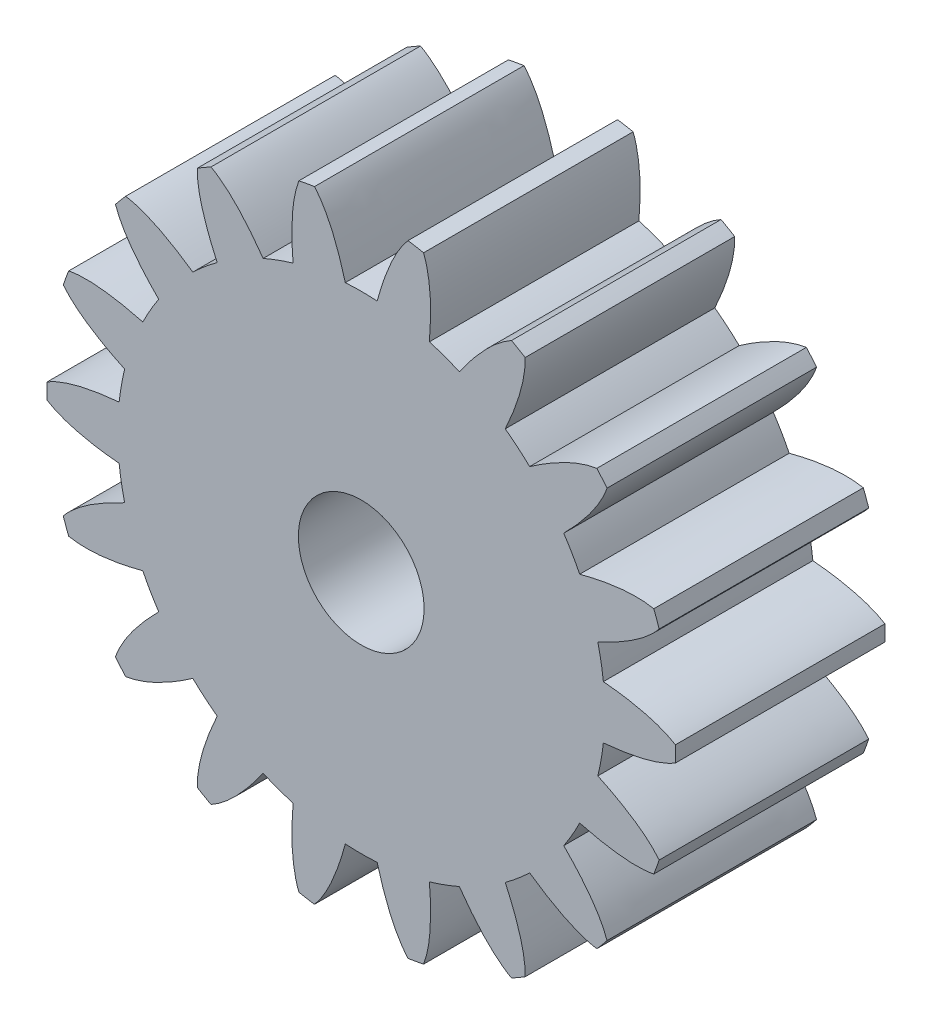
from build123d import *

# Parameters (mm, degrees)
SKETCH2_R           = 3
BOSS_EXTRUDE1_DEPTH = 10


with BuildPart() as part:
    # Sketch2 → Boss-Extrude1 (new body)
    with BuildSketch(Plane.XY):
        with BuildLine():
            ThreePointArc((-3.252993239, 11.159543494), (-3.975642146, 10.922987024), (-4.681278893, 10.639690029))
            add(Edge.make_bspline(
                [(-7.171179852, 13.174755388), (-6.030977377, 12.550803972), (-4.681278893, 10.639690029)],
                knots=[0, 0, 0, 0.715421341, 0.715421341, 0.715421341], degree=2))
            ThreePointArc((-7.171179852, 13.174755388), (-7.5, 12.990381057), (-7.824082928, 12.797801621))
            add(Edge.make_bspline(
                [(-7.824082928, 12.797801621), (-7.853826389, 11.498381604), (-6.873602407, 9.373951458)],
                knots=[0, 0, 0, 0.715421341, 0.715421341, 0.715421341], degree=2))
            ThreePointArc((-6.873602407, 9.373951458), (-7.471763175, 8.904500607), (-8.037951541, 8.39694653))
            add(Edge.make_bspline(
                [(-11.244736516, 9.927532458), (-9.95989271, 9.731182131), (-8.037951541, 8.39694653)],
                knots=[0, 0, 0, 0.715421341, 0.715421341, 0.715421341], degree=2))
            ThreePointArc((-11.244736516, 9.927532458), (-11.490666647, 9.641814145), (-11.729338937, 9.350005781))
            add(Edge.make_bspline(
                [(-11.729338937, 9.350005781), (-11.312860827, 8.118777517), (-9.665153682, 6.457722533)],
                knots=[0, 0, 0, 0.715421341, 0.715421341, 0.715421341], degree=2))
            ThreePointArc((-9.665153682, 6.457722533), (-10.066679294, 5.812), (-10.425128605, 5.141407354))
            add(Edge.make_bspline(
                [(-13.962012, 5.482902598), (-12.687497991, 5.737836107), (-10.425128605, 5.141407354)],
                knots=[0, 0, 0, 0.715421341, 0.715421341, 0.715421341], degree=2))
            ThreePointArc((-13.962012, 5.482902598), (-14.095389312, 5.13030215), (-14.219863563, 4.774461253))
            add(Edge.make_bspline(
                [(-14.219863563, 4.774461253), (-13.407397289, 3.759929041), (-11.29094478, 2.762596964)],
                knots=[0, 0, 0, 0.715421341, 0.715421341, 0.715421341], degree=2))
            ThreePointArc((-11.29094478, 2.762596964), (-11.447405321, 2.018486417), (-11.554881301, 1.265738571))
            add(Edge.make_bspline(
                [(-14.995262781, 0.376953767), (-13.884803766, 1.052422368), (-11.554881301, 1.265738571)],
                knots=[0, 0, 0, 0.715421341, 0.715421341, 0.715421341], degree=2))
            ThreePointArc((-14.995262781, 0.376953767), (-15, 0), (-14.995262781, -0.376953767))
            add(Edge.make_bspline(
                [(-14.995262781, -0.376953767), (-13.884803766, -1.052422368), (-11.554881301, -1.265738571)],
                knots=[0, 0, 0, 0.715421341, 0.715421341, 0.715421341], degree=2))
            ThreePointArc((-11.554881301, -1.265738571), (-11.447405321, -2.018486417), (-11.29094478, -2.762596964))
            add(Edge.make_bspline(
                [(-14.219863563, -4.774461253), (-13.407397289, -3.759929041), (-11.29094478, -2.762596964)],
                knots=[0, 0, 0, 0.715421341, 0.715421341, 0.715421341], degree=2))
            ThreePointArc((-14.219863563, -4.774461253), (-14.095389312, -5.13030215), (-13.962012, -5.482902598))
            add(Edge.make_bspline(
                [(-13.962012, -5.482902598), (-12.687497991, -5.737836107), (-10.425128605, -5.141407354)],
                knots=[0, 0, 0, 0.715421341, 0.715421341, 0.715421341], degree=2))
            ThreePointArc((-10.425128605, -5.141407354), (-10.066679294, -5.812), (-9.665153682, -6.457722533))
            add(Edge.make_bspline(
                [(-11.729338937, -9.350005781), (-11.312860827, -8.118777517), (-9.665153682, -6.457722533)],
                knots=[0, 0, 0, 0.715421341, 0.715421341, 0.715421341], degree=2))
            ThreePointArc((-11.729338937, -9.350005781), (-11.490666647, -9.641814145), (-11.244736516, -9.927532458))
            add(Edge.make_bspline(
                [(-11.244736516, -9.927532458), (-9.95989271, -9.731182131), (-8.037951541, -8.39694653)],
                knots=[0, 0, 0, 0.715421341, 0.715421341, 0.715421341], degree=2))
            ThreePointArc((-8.037951541, -8.39694653), (-7.471763175, -8.904500607), (-6.873602407, -9.373951458))
            add(Edge.make_bspline(
                [(-7.824082928, -12.797801621), (-7.853826389, -11.498381604), (-6.873602407, -9.373951458)],
                knots=[0, 0, 0, 0.715421341, 0.715421341, 0.715421341], degree=2))
            ThreePointArc((-7.824082928, -12.797801621), (-7.5, -12.990381057), (-7.171179852, -13.174755388))
            add(Edge.make_bspline(
                [(-7.171179852, -13.174755388), (-6.030977377, -12.550803972), (-4.681278893, -10.639690029)],
                knots=[0, 0, 0, 0.715421341, 0.715421341, 0.715421341], degree=2))
            ThreePointArc((-4.681278893, -10.639690029), (-3.975642146, -10.922987024), (-3.252993239, -11.159543494))
            add(Edge.make_bspline(
                [(-2.975127047, -14.70199371), (-3.447504579, -13.491111171), (-3.252993239, -11.159543494)],
                knots=[0, 0, 0, 0.715421341, 0.715421341, 0.715421341], degree=2))
            ThreePointArc((-2.975127047, -14.70199371), (-2.604722665, -14.772116295), (-2.232673064, -14.832908379))
            add(Edge.make_bspline(
                [(-2.232673064, -14.832908379), (-1.374637164, -13.856613624), (-0.759974923, -11.599129886)],
                knots=[0, 0, 0, 0.715421341, 0.715421341, 0.715421341], degree=2))
            ThreePointArc((-0.759974923, -11.599129886), (0, -11.624), (0.759974923, -11.599129886))
            add(Edge.make_bspline(
                [(2.232673064, -14.832908379), (1.374637164, -13.856613624), (0.759974923, -11.599129886)],
                knots=[0, 0, 0, 0.715421341, 0.715421341, 0.715421341], degree=2))
            ThreePointArc((2.232673064, -14.832908379), (2.604722665, -14.772116295), (2.975127047, -14.70199371))
            add(Edge.make_bspline(
                [(2.975127047, -14.70199371), (3.447504579, -13.491111171), (3.252993239, -11.159543494)],
                knots=[0, 0, 0, 0.715421341, 0.715421341, 0.715421341], degree=2))
            ThreePointArc((3.252993239, -11.159543494), (3.975642146, -10.922987024), (4.681278893, -10.639690029))
            add(Edge.make_bspline(
                [(7.171179852, -13.174755388), (6.030977377, -12.550803972), (4.681278893, -10.639690029)],
                knots=[0, 0, 0, 0.715421341, 0.715421341, 0.715421341], degree=2))
            ThreePointArc((7.171179852, -13.174755388), (7.5, -12.990381057), (7.824082928, -12.797801621))
            add(Edge.make_bspline(
                [(7.824082928, -12.797801621), (7.853826389, -11.498381604), (6.873602407, -9.373951458)],
                knots=[0, 0, 0, 0.715421341, 0.715421341, 0.715421341], degree=2))
            ThreePointArc((6.873602407, -9.373951458), (7.471763175, -8.904500607), (8.037951541, -8.39694653))
            add(Edge.make_bspline(
                [(11.244736516, -9.927532458), (9.95989271, -9.731182131), (8.037951541, -8.39694653)],
                knots=[0, 0, 0, 0.715421341, 0.715421341, 0.715421341], degree=2))
            ThreePointArc((11.244736516, -9.927532458), (11.490666647, -9.641814145), (11.729338937, -9.350005781))
            add(Edge.make_bspline(
                [(11.729338937, -9.350005781), (11.312860827, -8.118777517), (9.665153682, -6.457722533)],
                knots=[0, 0, 0, 0.715421341, 0.715421341, 0.715421341], degree=2))
            ThreePointArc((9.665153682, -6.457722533), (10.066679294, -5.812), (10.425128605, -5.141407354))
            add(Edge.make_bspline(
                [(13.962012, -5.482902598), (12.687497991, -5.737836107), (10.425128605, -5.141407354)],
                knots=[0, 0, 0, 0.715421341, 0.715421341, 0.715421341], degree=2))
            ThreePointArc((13.962012, -5.482902598), (14.095389312, -5.13030215), (14.219863563, -4.774461253))
            add(Edge.make_bspline(
                [(14.219863563, -4.774461253), (13.407397289, -3.759929041), (11.29094478, -2.762596964)],
                knots=[0, 0, 0, 0.715421341, 0.715421341, 0.715421341], degree=2))
            ThreePointArc((11.29094478, -2.762596964), (11.447405321, -2.018486417), (11.554881301, -1.265738571))
            add(Edge.make_bspline(
                [(14.995262781, -0.376953767), (13.884803766, -1.052422368), (11.554881301, -1.265738571)],
                knots=[0, 0, 0, 0.715421341, 0.715421341, 0.715421341], degree=2))
            ThreePointArc((14.995262781, -0.376953767), (15, 0), (14.995262781, 0.376953767))
            add(Edge.make_bspline(
                [(14.995262781, 0.376953767), (13.884803766, 1.052422368), (11.554881301, 1.265738571)],
                knots=[0, 0, 0, 0.715421341, 0.715421341, 0.715421341], degree=2))
            ThreePointArc((11.554881301, 1.265738571), (11.447405321, 2.018486417), (11.29094478, 2.762596964))
            add(Edge.make_bspline(
                [(14.219863563, 4.774461253), (13.407397289, 3.759929041), (11.29094478, 2.762596964)],
                knots=[0, 0, 0, 0.715421341, 0.715421341, 0.715421341], degree=2))
            ThreePointArc((14.219863563, 4.774461253), (14.095389312, 5.13030215), (13.962012, 5.482902598))
            add(Edge.make_bspline(
                [(13.962012, 5.482902598), (12.687497991, 5.737836107), (10.425128605, 5.141407354)],
                knots=[0, 0, 0, 0.715421341, 0.715421341, 0.715421341], degree=2))
            ThreePointArc((10.425128605, 5.141407354), (10.066679294, 5.812), (9.665153682, 6.457722533))
            add(Edge.make_bspline(
                [(11.729338937, 9.350005781), (11.312860827, 8.118777517), (9.665153682, 6.457722533)],
                knots=[0, 0, 0, 0.715421341, 0.715421341, 0.715421341], degree=2))
            ThreePointArc((11.729338937, 9.350005781), (11.490666647, 9.641814145), (11.244736516, 9.927532458))
            add(Edge.make_bspline(
                [(11.244736516, 9.927532458), (9.95989271, 9.731182131), (8.037951541, 8.39694653)],
                knots=[0, 0, 0, 0.715421341, 0.715421341, 0.715421341], degree=2))
            ThreePointArc((8.037951541, 8.39694653), (7.471763175, 8.904500607), (6.873602407, 9.373951458))
            add(Edge.make_bspline(
                [(7.824082928, 12.797801621), (7.853826389, 11.498381604), (6.873602407, 9.373951458)],
                knots=[0, 0, 0, 0.715421341, 0.715421341, 0.715421341], degree=2))
            ThreePointArc((7.824082928, 12.797801621), (7.5, 12.990381057), (7.171179852, 13.174755388))
            add(Edge.make_bspline(
                [(7.171179852, 13.174755388), (6.030977377, 12.550803972), (4.681278893, 10.639690029)],
                knots=[0, 0, 0, 0.715421341, 0.715421341, 0.715421341], degree=2))
            ThreePointArc((4.681278893, 10.639690029), (3.975642146, 10.922987024), (3.252993239, 11.159543494))
            add(Edge.make_bspline(
                [(2.975127047, 14.70199371), (3.447504579, 13.491111171), (3.252993239, 11.159543494)],
                knots=[0, 0, 0, 0.715421341, 0.715421341, 0.715421341], degree=2))
            ThreePointArc((2.975127047, 14.70199371), (2.604722665, 14.772116295), (2.232673064, 14.832908379))
            add(Edge.make_bspline(
                [(2.232673064, 14.832908379), (1.374637164, 13.856613624), (0.759974923, 11.599129886)],
                knots=[0, 0, 0, 0.715421341, 0.715421341, 0.715421341], degree=2))
            ThreePointArc((0.759974923, 11.599129886), (0, 11.624), (-0.759974923, 11.599129886))
            add(Edge.make_bspline(
                [(-2.232673064, 14.832908379), (-1.374637164, 13.856613624), (-0.759974923, 11.599129886)],
                knots=[0, 0, 0, 0.715421341, 0.715421341, 0.715421341], degree=2))
            ThreePointArc((-2.232673064, 14.832908379), (-2.604722665, 14.772116295), (-2.975127047, 14.70199371))
            add(Edge.make_bspline(
                [(-2.975127047, 14.70199371), (-3.447504579, 13.491111171), (-3.252993239, 11.159543494)],
                knots=[0, 0, 0, 0.715421341, 0.715421341, 0.715421341], degree=2))
        make_face()
        Circle(SKETCH2_R, mode=Mode.SUBTRACT)
    extrude(amount=BOSS_EXTRUDE1_DEPTH)


solid = part.part
